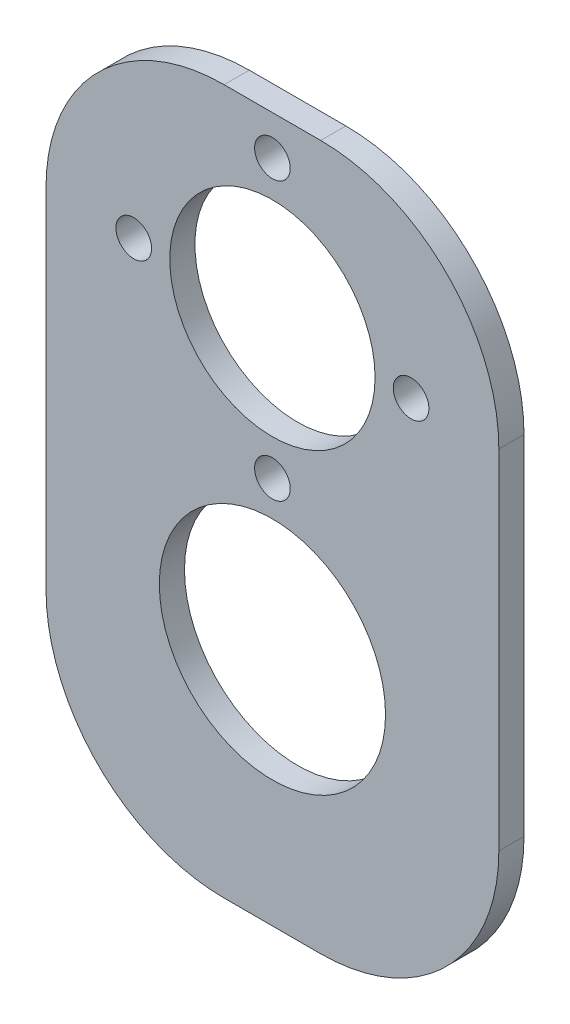
from build123d import *

# Parameters (mm, degrees)
SKETCH1_W           = 57.15
SKETCH1_H           = 88.9
SKETCH1_R           = 14.2748
SKETCH1_R_2         = 2.25
SKETCH1_R_3         = 12.954
BOSS_EXTRUDE1_DEPTH = 3.175
FILLET1_R           = 22.479


with BuildPart() as part:
    # Sketch1 → Boss-Extrude1 (new body)
    with BuildSketch(Plane.XY):
        with Locations((0, 10.014175534)):
            Rectangle(SKETCH1_W, SKETCH1_H)
        with Locations((0, -4.209824466)):
            Circle(SKETCH1_R, mode=Mode.SUBTRACT)
        with Locations((-17.5006, 31.985175534)):
            Circle(SKETCH1_R_2, mode=Mode.SUBTRACT)
        with Locations((0, 14.484575534)):
            Circle(SKETCH1_R_2, mode=Mode.SUBTRACT)
        with Locations((17.5006, 31.985175534)):
            Circle(SKETCH1_R_2, mode=Mode.SUBTRACT)
        with Locations((0, 49.485775534)):
            Circle(SKETCH1_R_2, mode=Mode.SUBTRACT)
        with Locations((0, 31.985175534)):
            Circle(SKETCH1_R_3, mode=Mode.SUBTRACT)
    extrude(amount=BOSS_EXTRUDE1_DEPTH)

    # Fillet1
    fillet1_edges = [part.edges().sort_by_distance(p)[0] for p in [
        (28.575, -34.435824466, 1.5875),
        (-28.575, -34.435824466, 1.5875),
        (-28.575, 54.464175534, 1.5875),
        (28.575, 54.464175534, 1.5875),
    ]]
    fillet(fillet1_edges, radius=FILLET1_R)


solid = part.part
